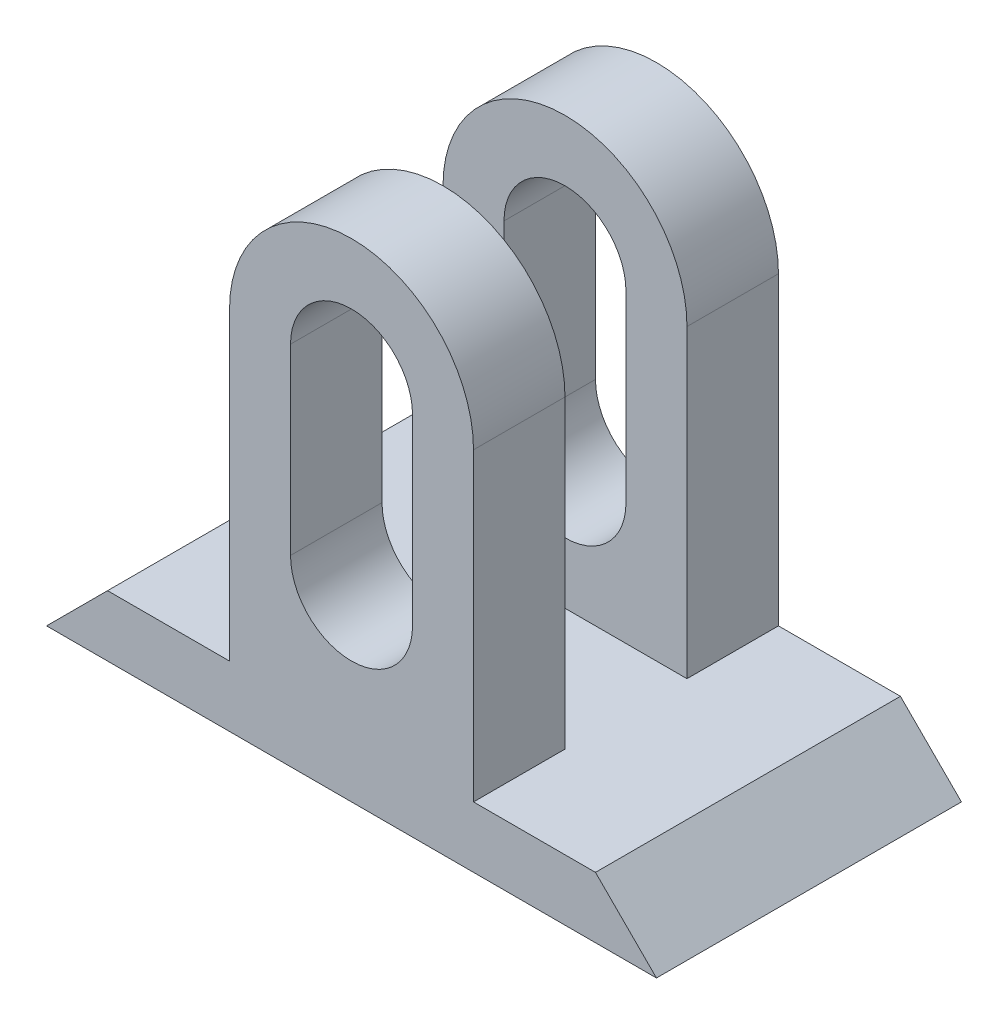
from build123d import *

# Parameters (mm, degrees)
BOSS_EXTRUDE1_DEPTH = 50
BOSS_EXTRUDE2_DEPTH = 15
BOSS_EXTRUDE3_START = 35
BOSS_EXTRUDE3_DEPTH = 15


with BuildPart() as part:
    # Sketch1 → Boss-Extrude1 (new body)
    with BuildSketch(Plane.XY):
        Polygon((30, 10), (70, 10), (90, 10), (100, 0), (0, 0), (10, 10), align=None)
    extrude(amount=BOSS_EXTRUDE1_DEPTH)

    # Sketch1<3> → Boss-Extrude2 (add)
    with BuildSketch(Plane.XY):
        with BuildLine():
            Line((70, 10), (70, 60))
            ThreePointArc((70, 60), (50, 80), (30, 60))
            Line((30, 60), (30, 10))
            Line((30, 10), (70, 10))
        make_face()
        with BuildLine():
            ThreePointArc((40, 30), (50, 20), (60, 30))
            Line((60, 30), (60, 60))
            ThreePointArc((60, 60), (50, 70), (40, 60))
            Line((40, 60), (40, 30))
        make_face(mode=Mode.SUBTRACT)
    extrude(amount=BOSS_EXTRUDE2_DEPTH)

    # Sketch1<4> → Boss-Extrude3 (add)
    with BuildSketch(Plane.XY.offset(BOSS_EXTRUDE3_START)):
        with BuildLine():
            Line((70, 10), (70, 60))
            ThreePointArc((70, 60), (50, 80), (30, 60))
            Line((30, 60), (30, 10))
            Line((30, 10), (70, 10))
        make_face()
        with BuildLine():
            ThreePointArc((40, 30), (50, 20), (60, 30))
            Line((60, 30), (60, 60))
            ThreePointArc((60, 60), (50, 70), (40, 60))
            Line((40, 60), (40, 30))
        make_face(mode=Mode.SUBTRACT)
    extrude(amount=BOSS_EXTRUDE3_DEPTH)


solid = part.part
